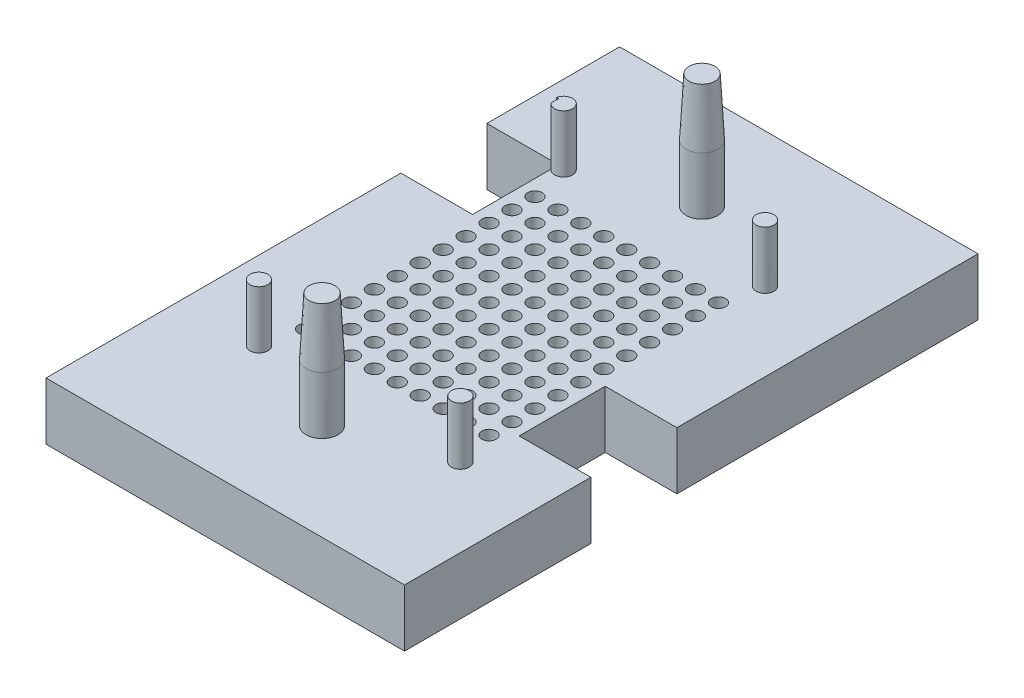
from build123d import *

# Parameters (mm, degrees)
SKETCH1_W           = 50
SKETCH1_H           = 80
SKETCH1_R           = 1
BOSS_EXTRUDE1_DEPTH = 8
SKETCH2_R           = 2.225
SKETCH2_R_2         = 1.25
BOSS_EXTRUDE2_DEPTH = 8
SKETCH5_W           = 10
SKETCH5_H           = 12
CUT_EXTRUDE2_DEPTH  = 98.344748189


with BuildPart() as part:
    # Sketch1 → Boss-Extrude1 (new body)
    with BuildSketch(Plane(origin=(0, 0, 0), x_dir=(1, 0, 0), z_dir=(0, 1, 0))):
        with Locations((25, 40)):
            Rectangle(SKETCH1_W, SKETCH1_H)
        with Locations(Location((25, 40, 0), (0, 0, 270))):
            Circle(SKETCH1_R, mode=Mode.SUBTRACT)
        with Locations(Location((28.2, 40, 0), (0, 0, 270))):
            Circle(SKETCH1_R, mode=Mode.SUBTRACT)
        with Locations(Location((31.4, 40, 0), (0, 0, 270))):
            Circle(SKETCH1_R, mode=Mode.SUBTRACT)
        with Locations(Location((34.6, 40, 0), (0, 0, 270))):
            Circle(SKETCH1_R, mode=Mode.SUBTRACT)
        with Locations(Location((37.8, 40, 0), (0, 0, 270))):
            Circle(SKETCH1_R, mode=Mode.SUBTRACT)
        with Locations(Location((28.2, 43.2, 0), (0, 0, 270))):
            Circle(SKETCH1_R, mode=Mode.SUBTRACT)
        with Locations(Location((31.4, 43.2, 0), (0, 0, 270))):
            Circle(SKETCH1_R, mode=Mode.SUBTRACT)
        with Locations(Location((34.6, 43.2, 0), (0, 0, 270))):
            Circle(SKETCH1_R, mode=Mode.SUBTRACT)
        with Locations(Location((37.8, 43.2, 0), (0, 0, 270))):
            Circle(SKETCH1_R, mode=Mode.SUBTRACT)
        with Locations(Location((28.2, 46.4, 0), (0, 0, 270))):
            Circle(SKETCH1_R, mode=Mode.SUBTRACT)
        with Locations(Location((31.4, 46.4, 0), (0, 0, 270))):
            Circle(SKETCH1_R, mode=Mode.SUBTRACT)
        with Locations(Location((34.6, 46.4, 0), (0, 0, 270))):
            Circle(SKETCH1_R, mode=Mode.SUBTRACT)
        with Locations(Location((37.8, 46.4, 0), (0, 0, 270))):
            Circle(SKETCH1_R, mode=Mode.SUBTRACT)
        with Locations(Location((28.2, 49.6, 0), (0, 0, 270))):
            Circle(SKETCH1_R, mode=Mode.SUBTRACT)
        with Locations(Location((31.4, 49.6, 0), (0, 0, 270))):
            Circle(SKETCH1_R, mode=Mode.SUBTRACT)
        with Locations(Location((34.6, 49.6, 0), (0, 0, 270))):
            Circle(SKETCH1_R, mode=Mode.SUBTRACT)
        with Locations(Location((37.8, 49.6, 0), (0, 0, 270))):
            Circle(SKETCH1_R, mode=Mode.SUBTRACT)
        with Locations(Location((28.2, 52.8, 0), (0, 0, 270))):
            Circle(SKETCH1_R, mode=Mode.SUBTRACT)
        with Locations(Location((31.4, 52.8, 0), (0, 0, 270))):
            Circle(SKETCH1_R, mode=Mode.SUBTRACT)
        with Locations(Location((34.6, 52.8, 0), (0, 0, 270))):
            Circle(SKETCH1_R, mode=Mode.SUBTRACT)
        with Locations(Location((37.8, 52.8, 0), (0, 0, 270))):
            Circle(SKETCH1_R, mode=Mode.SUBTRACT)
        with Locations(Location((28.2, 56, 0), (0, 0, 270))):
            Circle(SKETCH1_R, mode=Mode.SUBTRACT)
        with Locations(Location((31.4, 56, 0), (0, 0, 270))):
            Circle(SKETCH1_R, mode=Mode.SUBTRACT)
        with Locations(Location((34.6, 56, 0), (0, 0, 270))):
            Circle(SKETCH1_R, mode=Mode.SUBTRACT)
        with Locations(Location((37.8, 56, 0), (0, 0, 270))):
            Circle(SKETCH1_R, mode=Mode.SUBTRACT)
        with Locations(Location((25, 43.2, 0), (0, 0, 270))):
            Circle(SKETCH1_R, mode=Mode.SUBTRACT)
        with Locations(Location((25, 46.4, 0), (0, 0, 270))):
            Circle(SKETCH1_R, mode=Mode.SUBTRACT)
        with Locations(Location((25, 49.6, 0), (0, 0, 270))):
            Circle(SKETCH1_R, mode=Mode.SUBTRACT)
        with Locations(Location((25, 52.8, 0), (0, 0, 270))):
            Circle(SKETCH1_R, mode=Mode.SUBTRACT)
        with Locations(Location((25, 56, 0), (0, 0, 270))):
            Circle(SKETCH1_R, mode=Mode.SUBTRACT)
        with Locations(Location((21.8, 40, 0), (0, 0, 270))):
            Circle(SKETCH1_R, mode=Mode.SUBTRACT)
        with Locations(Location((21.8, 43.2, 0), (0, 0, 270))):
            Circle(SKETCH1_R, mode=Mode.SUBTRACT)
        with Locations(Location((21.8, 46.4, 0), (0, 0, 270))):
            Circle(SKETCH1_R, mode=Mode.SUBTRACT)
        with Locations(Location((21.8, 49.6, 0), (0, 0, 270))):
            Circle(SKETCH1_R, mode=Mode.SUBTRACT)
        with Locations(Location((21.8, 52.8, 0), (0, 0, 270))):
            Circle(SKETCH1_R, mode=Mode.SUBTRACT)
        with Locations(Location((21.8, 56, 0), (0, 0, 270))):
            Circle(SKETCH1_R, mode=Mode.SUBTRACT)
        with Locations(Location((18.6, 40, 0), (0, 0, 270))):
            Circle(SKETCH1_R, mode=Mode.SUBTRACT)
        with Locations(Location((18.6, 43.2, 0), (0, 0, 270))):
            Circle(SKETCH1_R, mode=Mode.SUBTRACT)
        with Locations(Location((18.6, 46.4, 0), (0, 0, 270))):
            Circle(SKETCH1_R, mode=Mode.SUBTRACT)
        with Locations(Location((18.6, 49.6, 0), (0, 0, 270))):
            Circle(SKETCH1_R, mode=Mode.SUBTRACT)
        with Locations(Location((18.6, 52.8, 0), (0, 0, 270))):
            Circle(SKETCH1_R, mode=Mode.SUBTRACT)
        with Locations(Location((18.6, 56, 0), (0, 0, 270))):
            Circle(SKETCH1_R, mode=Mode.SUBTRACT)
        with Locations(Location((15.4, 40, 0), (0, 0, 270))):
            Circle(SKETCH1_R, mode=Mode.SUBTRACT)
        with Locations(Location((15.4, 43.2, 0), (0, 0, 270))):
            Circle(SKETCH1_R, mode=Mode.SUBTRACT)
        with Locations(Location((15.4, 46.4, 0), (0, 0, 270))):
            Circle(SKETCH1_R, mode=Mode.SUBTRACT)
        with Locations(Location((15.4, 49.6, 0), (0, 0, 270))):
            Circle(SKETCH1_R, mode=Mode.SUBTRACT)
        with Locations(Location((15.4, 52.8, 0), (0, 0, 270))):
            Circle(SKETCH1_R, mode=Mode.SUBTRACT)
        with Locations(Location((15.4, 56, 0), (0, 0, 270))):
            Circle(SKETCH1_R, mode=Mode.SUBTRACT)
        with Locations(Location((12.2, 40, 0), (0, 0, 270))):
            Circle(SKETCH1_R, mode=Mode.SUBTRACT)
        with Locations(Location((12.2, 43.2, 0), (0, 0, 270))):
            Circle(SKETCH1_R, mode=Mode.SUBTRACT)
        with Locations(Location((12.2, 46.4, 0), (0, 0, 270))):
            Circle(SKETCH1_R, mode=Mode.SUBTRACT)
        with Locations(Location((12.2, 49.6, 0), (0, 0, 270))):
            Circle(SKETCH1_R, mode=Mode.SUBTRACT)
        with Locations(Location((12.2, 52.8, 0), (0, 0, 270))):
            Circle(SKETCH1_R, mode=Mode.SUBTRACT)
        with Locations(Location((12.2, 56, 0), (0, 0, 270))):
            Circle(SKETCH1_R, mode=Mode.SUBTRACT)
        with Locations(Location((25, 36.8, 0), (0, 0, 270))):
            Circle(SKETCH1_R, mode=Mode.SUBTRACT)
        with Locations(Location((28.2, 36.8, 0), (0, 0, 270))):
            Circle(SKETCH1_R, mode=Mode.SUBTRACT)
        with Locations(Location((31.4, 36.8, 0), (0, 0, 270))):
            Circle(SKETCH1_R, mode=Mode.SUBTRACT)
        with Locations(Location((34.6, 36.8, 0), (0, 0, 270))):
            Circle(SKETCH1_R, mode=Mode.SUBTRACT)
        with Locations(Location((37.8, 36.8, 0), (0, 0, 270))):
            Circle(SKETCH1_R, mode=Mode.SUBTRACT)
        with Locations(Location((21.8, 36.8, 0), (0, 0, 270))):
            Circle(SKETCH1_R, mode=Mode.SUBTRACT)
        with Locations(Location((18.6, 36.8, 0), (0, 0, 270))):
            Circle(SKETCH1_R, mode=Mode.SUBTRACT)
        with Locations(Location((15.4, 36.8, 0), (0, 0, 270))):
            Circle(SKETCH1_R, mode=Mode.SUBTRACT)
        with Locations(Location((12.2, 36.8, 0), (0, 0, 270))):
            Circle(SKETCH1_R, mode=Mode.SUBTRACT)
        with Locations(Location((25, 33.6, 0), (0, 0, 270))):
            Circle(SKETCH1_R, mode=Mode.SUBTRACT)
        with Locations(Location((28.2, 33.6, 0), (0, 0, 270))):
            Circle(SKETCH1_R, mode=Mode.SUBTRACT)
        with Locations(Location((31.4, 33.6, 0), (0, 0, 270))):
            Circle(SKETCH1_R, mode=Mode.SUBTRACT)
        with Locations(Location((34.6, 33.6, 0), (0, 0, 270))):
            Circle(SKETCH1_R, mode=Mode.SUBTRACT)
        with Locations(Location((37.8, 33.6, 0), (0, 0, 270))):
            Circle(SKETCH1_R, mode=Mode.SUBTRACT)
        with Locations(Location((21.8, 33.6, 0), (0, 0, 270))):
            Circle(SKETCH1_R, mode=Mode.SUBTRACT)
        with Locations(Location((18.6, 33.6, 0), (0, 0, 270))):
            Circle(SKETCH1_R, mode=Mode.SUBTRACT)
        with Locations(Location((15.4, 33.6, 0), (0, 0, 270))):
            Circle(SKETCH1_R, mode=Mode.SUBTRACT)
        with Locations(Location((12.2, 33.6, 0), (0, 0, 270))):
            Circle(SKETCH1_R, mode=Mode.SUBTRACT)
        with Locations(Location((25, 30.4, 0), (0, 0, 270))):
            Circle(SKETCH1_R, mode=Mode.SUBTRACT)
        with Locations(Location((28.2, 30.4, 0), (0, 0, 270))):
            Circle(SKETCH1_R, mode=Mode.SUBTRACT)
        with Locations(Location((31.4, 30.4, 0), (0, 0, 270))):
            Circle(SKETCH1_R, mode=Mode.SUBTRACT)
        with Locations(Location((34.6, 30.4, 0), (0, 0, 270))):
            Circle(SKETCH1_R, mode=Mode.SUBTRACT)
        with Locations(Location((37.8, 30.4, 0), (0, 0, 270))):
            Circle(SKETCH1_R, mode=Mode.SUBTRACT)
        with Locations(Location((21.8, 30.4, 0), (0, 0, 270))):
            Circle(SKETCH1_R, mode=Mode.SUBTRACT)
        with Locations(Location((18.6, 30.4, 0), (0, 0, 270))):
            Circle(SKETCH1_R, mode=Mode.SUBTRACT)
        with Locations(Location((15.4, 30.4, 0), (0, 0, 270))):
            Circle(SKETCH1_R, mode=Mode.SUBTRACT)
        with Locations(Location((12.2, 30.4, 0), (0, 0, 270))):
            Circle(SKETCH1_R, mode=Mode.SUBTRACT)
        with Locations(Location((25, 27.2, 0), (0, 0, 270))):
            Circle(SKETCH1_R, mode=Mode.SUBTRACT)
        with Locations(Location((28.2, 27.2, 0), (0, 0, 270))):
            Circle(SKETCH1_R, mode=Mode.SUBTRACT)
        with Locations(Location((31.4, 27.2, 0), (0, 0, 270))):
            Circle(SKETCH1_R, mode=Mode.SUBTRACT)
        with Locations(Location((34.6, 27.2, 0), (0, 0, 270))):
            Circle(SKETCH1_R, mode=Mode.SUBTRACT)
        with Locations(Location((37.8, 27.2, 0), (0, 0, 270))):
            Circle(SKETCH1_R, mode=Mode.SUBTRACT)
        with Locations(Location((21.8, 27.2, 0), (0, 0, 270))):
            Circle(SKETCH1_R, mode=Mode.SUBTRACT)
        with Locations(Location((18.6, 27.2, 0), (0, 0, 270))):
            Circle(SKETCH1_R, mode=Mode.SUBTRACT)
        with Locations(Location((15.4, 27.2, 0), (0, 0, 270))):
            Circle(SKETCH1_R, mode=Mode.SUBTRACT)
        with Locations(Location((12.2, 27.2, 0), (0, 0, 270))):
            Circle(SKETCH1_R, mode=Mode.SUBTRACT)
        with Locations(Location((25, 24, 0), (0, 0, 270))):
            Circle(SKETCH1_R, mode=Mode.SUBTRACT)
        with Locations(Location((28.2, 24, 0), (0, 0, 270))):
            Circle(SKETCH1_R, mode=Mode.SUBTRACT)
        with Locations(Location((31.4, 24, 0), (0, 0, 270))):
            Circle(SKETCH1_R, mode=Mode.SUBTRACT)
        with Locations(Location((34.6, 24, 0), (0, 0, 270))):
            Circle(SKETCH1_R, mode=Mode.SUBTRACT)
        with Locations(Location((37.8, 24, 0), (0, 0, 270))):
            Circle(SKETCH1_R, mode=Mode.SUBTRACT)
        with Locations(Location((21.8, 24, 0), (0, 0, 270))):
            Circle(SKETCH1_R, mode=Mode.SUBTRACT)
        with Locations(Location((18.6, 24, 0), (0, 0, 270))):
            Circle(SKETCH1_R, mode=Mode.SUBTRACT)
        with Locations(Location((15.4, 24, 0), (0, 0, 270))):
            Circle(SKETCH1_R, mode=Mode.SUBTRACT)
        with Locations(Location((12.2, 24, 0), (0, 0, 270))):
            Circle(SKETCH1_R, mode=Mode.SUBTRACT)
    extrude(amount=BOSS_EXTRUDE1_DEPTH)

    # Sketch2 → Boss-Extrude2 (add)
    with BuildSketch(Plane(origin=(0, 8, 0), x_dir=(1, 0, 0), z_dir=(0, 1, 0))):
        with Locations(Location((25, 66.5, 0), (0, 0, 90))):
            Circle(SKETCH2_R)
        with Locations(Location((10.95, 61.25, 0), (0, 0, 90))):
            Circle(SKETCH2_R_2)
        with Locations(Location((39.05, 61.25, 0), (0, 0, 90))):
            Circle(SKETCH2_R_2)
        with Locations(Location((39.05, 18.75, 0), (0, 0, 90))):
            Circle(SKETCH2_R_2)
        with Locations(Location((10.95, 18.75, 0), (0, 0, 90))):
            Circle(SKETCH2_R_2)
        with Locations(Location((25, 13.5, 0), (0, 0, 90))):
            Circle(SKETCH2_R)
    extrude(amount=BOSS_EXTRUDE2_DEPTH)

    # Sketch3 → Revolve1 (revolve)
    with BuildSketch(Plane.ZY.offset(-25)):
        Polygon((-66.5, 16), (-66.5, 24), (-68.3, 24), (-68.725, 16), align=None)
    revolve1 = revolve(axis=Axis((25, 16, -66.5), (0, 1, 0)))

    # Mirror1: Revolve1 across plane
    add(revolve1.mirror(Plane(origin=(0, 0, -40), x_dir=(1, 0, 0), z_dir=(0, 0, -1))))

    # Sketch5 → Cut-Extrude2 (cut, through all)
    with BuildSketch(Plane.XZ):
        with Locations((5, -55.5)):
            Rectangle(SKETCH5_W, SKETCH5_H)
        with Locations((45, -32)):
            Rectangle(SKETCH5_W, SKETCH5_H)
    extrude(amount=-CUT_EXTRUDE2_DEPTH, mode=Mode.SUBTRACT)


solid = part.part
